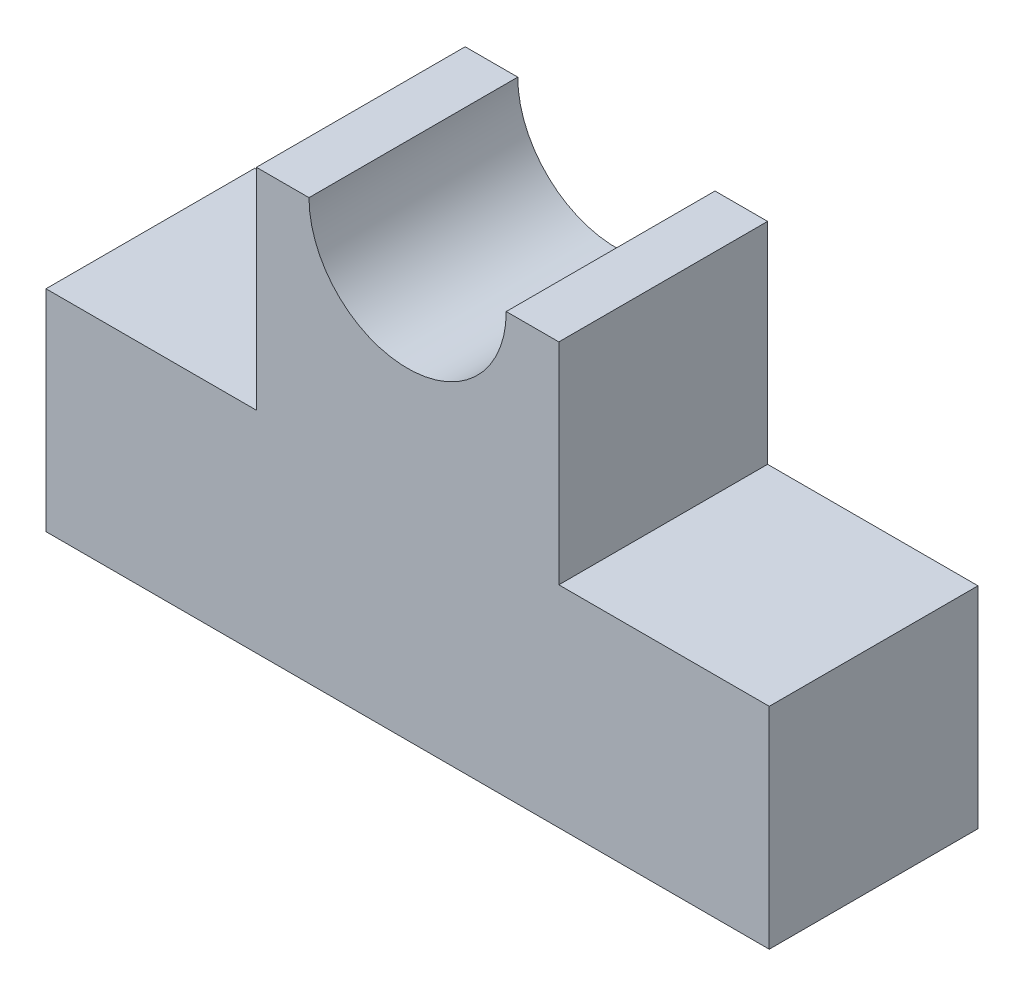
from build123d import *

# Parameters (mm, degrees)
BOSS_EXTRUDE1_DEPTH = 6.35


with BuildPart() as part:
    # Sketch1 → Boss-Extrude1 (new body)
    with BuildSketch(Plane.XY):
        with BuildLine():
            Line((-3, 9.6), (-4.6, 9.6))
            Line((-4.6, 9.6), (-4.6, 3.2))
            Line((-4.6, 3.2), (-11, 3.2))
            Line((-11, 3.2), (-11, -3.2))
            Line((-11, -3.2), (11, -3.2))
            Line((11, -3.2), (11, 3.2))
            Line((11, 3.2), (4.6, 3.2))
            Line((4.6, 3.2), (4.6, 9.6))
            Line((4.6, 9.6), (3, 9.6))
            ThreePointArc((3, 9.6), (0, 6.6), (-3, 9.6))
        make_face()
    extrude(amount=BOSS_EXTRUDE1_DEPTH)


solid = part.part
